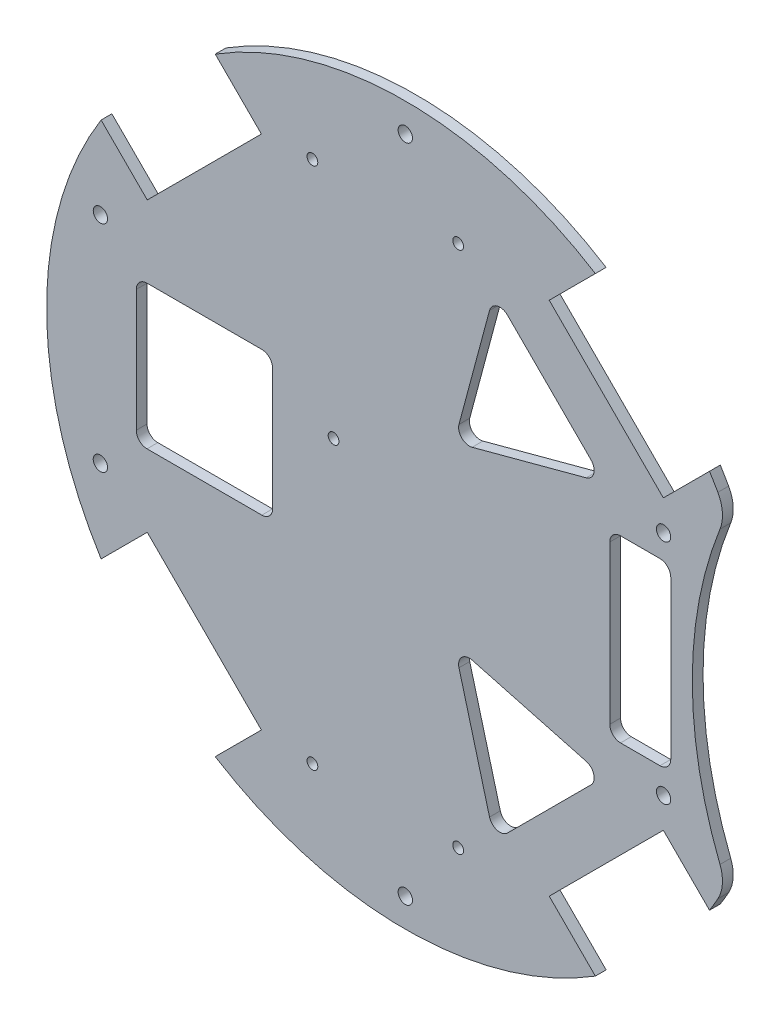
from build123d import *

# Parameters (mm, degrees)
CROQUIS1_R              = 100
SALIENTE_EXTRUIR1_DEPTH = 3
CROQUIS3_R              = 110
CORTAR_EXTRUIR1_DEPTH   = 3
REDONDEO1_R             = 10
CORTAR_EXTRUIR3_DEPTH   = 10
CROQUIS10_R             = 1.5
CORTAR_EXTRUIR4_DEPTH   = 142.453172607
CROQUIS11_R             = 2
CROQUIS11_W             = 17
CROQUIS11_H             = 50
CROQUIS11_W_2           = 38
CROQUIS11_H_2           = 40
CORTAR_EXTRUIR5_DEPTH   = 10
REDONDEO2_R             = 3


with BuildPart() as part:
    # Croquis1 → Saliente-Extruir1 (new body)
    with BuildSketch(Plane.XY):
        Circle(CROQUIS1_R)
    extrude(amount=SALIENTE_EXTRUIR1_DEPTH)

    # Croquis3 → Cortar-Extruir1 (cut)
    with BuildSketch(Plane.XY.offset(3)):
        with Locations((190, 0)):
            Circle(CROQUIS3_R)
    extrude(amount=-CORTAR_EXTRUIR1_DEPTH, mode=Mode.SUBTRACT)

    # Redondeo1
    redondeo1_edges = [part.edges().sort_by_distance(p)[0] for p in [
        (89.473684211, -44.659375654, 1.5),
        (89.473684211, 44.659375654, 1.5),
    ]]
    fillet(redondeo1_edges, radius=REDONDEO1_R)

    # Croquis7 → Cortar-Extruir3 (cut)
    with BuildSketch(Plane.XY.offset(3)):
        Polygon((-71.939339828, -40.119534675), (-40.119534675, -71.939339828), (-57.797204204, -89.617009358), (-89.617009358, -57.797204204), align=None)
        Polygon((-40.119534675, 71.939339828), (-71.939339828, 40.119534675), (-89.617009358, 57.797204204), (-57.797204204, 89.617009358), align=None)
        Polygon((71.939339828, 40.119534675), (40.119534675, 71.939339828), (57.797204204, 89.617009358), (89.617009358, 57.797204204), align=None)
        Polygon((40.119534675, -71.939339828), (71.939339828, -40.119534675), (89.617009358, -57.797204204), (57.797204204, -89.617009358), align=None)
    extrude(amount=-CORTAR_EXTRUIR3_DEPTH, mode=Mode.SUBTRACT)

    # Croquis10 → Cortar-Extruir4 (cut, through all)
    with BuildSketch(Plane.XY.offset(3)):
        with Locations((-20, 8.5)):
            Circle(CROQUIS10_R)
        with Locations((14.74, 72.95)):
            Circle(CROQUIS10_R)
        with Locations((-25.9, 72.95)):
            Circle(CROQUIS10_R)
        with Locations(Location((14.74, -72.95, 0), (0, 0, 180))):
            Circle(CROQUIS10_R)
        with Locations(Location((-25.9, -72.95, 0), (0, 0, 180))):
            Circle(CROQUIS10_R)
    extrude(amount=-CORTAR_EXTRUIR4_DEPTH, mode=Mode.SUBTRACT)

    # Croquis11 → Cortar-Extruir5 (cut)
    with BuildSketch(Plane.XY.offset(3)):
        with Locations((0, 92)):
            Circle(CROQUIS11_R)
        with Locations((0, -92)):
            Circle(CROQUIS11_R)
        with Locations((72, 31.694913472)):
            Circle(CROQUIS11_R)
        with Locations((72, -31.694913472)):
            Circle(CROQUIS11_R)
        with Locations((-85, -30)):
            Circle(CROQUIS11_R)
        with Locations((-85, 30)):
            Circle(CROQUIS11_R)
        with Locations((65.5, 0)):
            Rectangle(CROQUIS11_W, CROQUIS11_H)
        Polygon((55.443488939, 35.561561695), (24.824867154, 66.18018348), (13.617673752, 24.354368293), align=None)
        Polygon((13.617673752, -24.354368293), (55.443488939, -35.561561695), (24.824867154, -66.18018348), align=None)
        with Locations((-56, 0)):
            Rectangle(CROQUIS11_W_2, CROQUIS11_H_2)
    extrude(amount=-CORTAR_EXTRUIR5_DEPTH, mode=Mode.SUBTRACT)

    # Redondeo2
    redondeo2_edges = [part.edges().sort_by_distance(p)[0] for p in [
        (74, 25, 1.5),
        (74, -25, 1.5),
        (57, -25, 1.5),
        (57, 25, 1.5),
        (55.443488939, 35.561561695, 1.5),
        (13.617673752, 24.354368293, 1.5),
        (24.824867154, 66.18018348, 1.5),
        (24.824867154, -66.18018348, 1.5),
        (13.617673752, -24.354368293, 1.5),
        (55.443488939, -35.561561695, 1.5),
        (-37, 20, 1.5),
        (-37, -20, 1.5),
        (-75, -20, 1.5),
        (-75, 20, 1.5),
    ]]
    fillet(redondeo2_edges, radius=REDONDEO2_R)


solid = part.part
